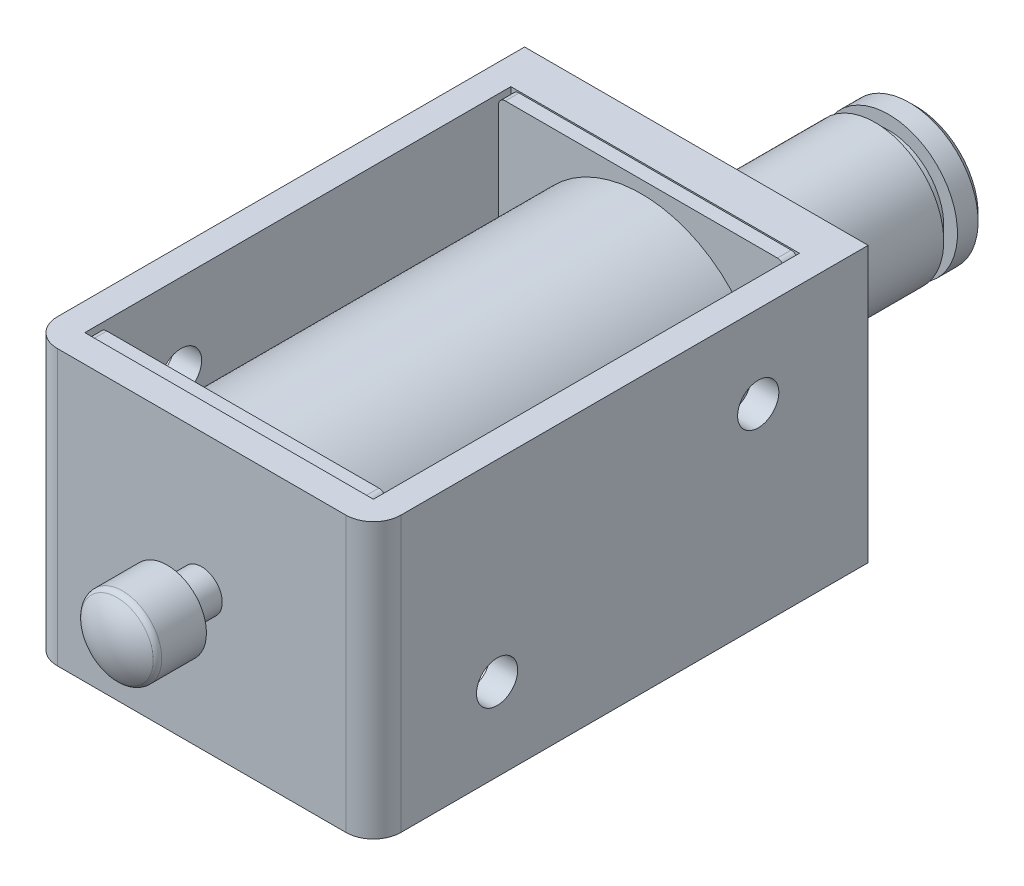
from build123d import *

# Parameters (mm, degrees)
SKETCH_1_W          = 21
SKETCH_1_H          = 31
EXTRUDE_1_DEPTH     = 20
CUT_EXTRUDE_5_REACH = 50.177
SKETCH_14_R         = 1.5
CUT_EXTRUDE_6_REACH = 50.177
SKETCH_15_R         = 1.5
EXTRUDE_2_DEPTH     = 1
EXTRUDE_START       = 1
EXTRUDE_3_DEPTH     = 1
SKETCH_4_R          = 1.5
CUT_EXTRUDE_1_DEPTH = 3
SKETCH_5_R          = 5
CUT_EXTRUDE_2_DEPTH = 4
SKETCH_6_W          = 9
SKETCH_6_H          = 29
EXTRUDE_START_2     = -8
SKETCH_7_R          = 1.5
EXTRUDE_4_DEPTH     = 8
EXTRUDE_START_3     = 20
SKETCH_8_R          = 5
EXTRUDE_5_DEPTH     = 20
SKETCH_10_R         = 1.75
CUT_EXTRUDE_4_DEPTH = 20
SKETCH_9_R          = 5
SKETCH_9_R_2        = 4
CUT_EXTRUDE_3_DEPTH = 1
SKETCH_11_R         = 2.85
EXTRUDE_6_DEPTH     = 3.5
FILLET_1_R          = 0.5
CHAMFER_1_SIZE      = 0.5


with BuildPart() as part:
    # ｽｹｯﾁ1 → ﾎﾞｽ - 押し出し1 (new body)
    with BuildSketch(Plane(origin=(0, 0, 0), x_dir=(1, 0, 0), z_dir=(0, 1, 0))):
        with BuildLine():
            Line((2, 0), (23, 0))
            ThreePointArc((23, 0), (24.414213562, 0.585786438), (25, 2))
            Line((25, 2), (25, 36))
            Line((25, 36), (0, 36))
            Line((0, 36), (0, 2))
            ThreePointArc((0, 2), (0.585786438, 0.585786438), (2, 0))
        make_face()
        with Locations((12.5, 17.5)):
            Rectangle(SKETCH_1_W, SKETCH_1_H, mode=Mode.SUBTRACT)
    extrude(amount=EXTRUDE_1_DEPTH)

    # ｽｹｯﾁ14 → ｶｯﾄ - 押し出し5 (cut, up to next)
    with BuildSketch(Plane(origin=(25, 0, 0), x_dir=(0, 0, -1), z_dir=(1, 0, 0)), mode=Mode.PRIVATE) as cut_extrude_5_sk1:
        with Locations((9, 6)):
            Circle(SKETCH_14_R)
    cut_extrude_5_tool1 = extrude(cut_extrude_5_sk1.sketch, amount=-CUT_EXTRUDE_5_REACH, mode=Mode.PRIVATE) & part.part
    # ｽｹｯﾁ14 → ｶｯﾄ - 押し出し5 (cut, up to next)
    with BuildSketch(Plane(origin=(25, 0, 0), x_dir=(0, 0, -1), z_dir=(1, 0, 0)), mode=Mode.PRIVATE) as cut_extrude_5_sk2:
        with Locations((28, 14)):
            Circle(SKETCH_14_R)
    cut_extrude_5_tool2 = extrude(cut_extrude_5_sk2.sketch, amount=-CUT_EXTRUDE_5_REACH, mode=Mode.PRIVATE) & part.part
    add(cut_extrude_5_tool1.solids().sort_by_distance((25, 6, -9))[0], mode=Mode.SUBTRACT)
    add(cut_extrude_5_tool2.solids().sort_by_distance((25, 14, -28))[0], mode=Mode.SUBTRACT)

    # ｽｹｯﾁ15 → ｶｯﾄ - 押し出し6 (cut, up to next)
    with BuildSketch(Plane.ZY, mode=Mode.PRIVATE) as cut_extrude_6_sk1:
        with Locations((-28, 6)):
            Circle(SKETCH_15_R)
    cut_extrude_6_tool1 = extrude(cut_extrude_6_sk1.sketch, amount=-CUT_EXTRUDE_6_REACH, mode=Mode.PRIVATE) & part.part
    # ｽｹｯﾁ15 → ｶｯﾄ - 押し出し6 (cut, up to next)
    with BuildSketch(Plane.ZY, mode=Mode.PRIVATE) as cut_extrude_6_sk2:
        with Locations((-9, 14)):
            Circle(SKETCH_15_R)
    cut_extrude_6_tool2 = extrude(cut_extrude_6_sk2.sketch, amount=-CUT_EXTRUDE_6_REACH, mode=Mode.PRIVATE) & part.part
    add(cut_extrude_6_tool1.solids().sort_by_distance((0, 6, -28))[0], mode=Mode.SUBTRACT)
    add(cut_extrude_6_tool2.solids().sort_by_distance((0, 14, -9))[0], mode=Mode.SUBTRACT)

    # ｽｹｯﾁ2 → ﾎﾞｽ - 押し出し2 (add)
    with BuildSketch(Plane(origin=(0, 0, -2), x_dir=(-1, 0, 0), z_dir=(0, 0, -1))):
        with BuildLine():
            Line((-22.4, 0.1), (-2.6, 0.1))
            ThreePointArc((-2.6, 0.1), (-2.246446609, 0.246446609), (-2.1, 0.6))
            Line((-2.1, 0.6), (-2.1, 19.4))
            ThreePointArc((-2.1, 19.4), (-2.246446609, 19.753553391), (-2.6, 19.9))
            Line((-2.6, 19.9), (-22.4, 19.9))
            ThreePointArc((-22.4, 19.9), (-22.753553391, 19.753553391), (-22.9, 19.4))
            Line((-22.9, 19.4), (-22.9, 0.6))
            ThreePointArc((-22.9, 0.6), (-22.753553391, 0.246446609), (-22.4, 0.1))
        make_face()
    extrude(amount=EXTRUDE_2_DEPTH)

    # ｽｹｯﾁ3 → ﾎﾞｽ - 押し出し3 (add)
    with BuildSketch(Plane.XY.offset(-33).offset(EXTRUDE_START)):
        with BuildLine():
            Line((2.6, 0.1), (22.4, 0.1))
            ThreePointArc((22.4, 0.1), (22.753553391, 0.246446609), (22.9, 0.6))
            Line((22.9, 0.6), (22.9, 19.4))
            ThreePointArc((22.9, 19.4), (22.753553391, 19.753553391), (22.4, 19.9))
            Line((22.4, 19.9), (2.6, 19.9))
            ThreePointArc((2.6, 19.9), (2.246446609, 19.753553391), (2.1, 19.4))
            Line((2.1, 19.4), (2.1, 0.6))
            ThreePointArc((2.1, 0.6), (2.246446609, 0.246446609), (2.6, 0.1))
        make_face()
    extrude(amount=-EXTRUDE_3_DEPTH)

    # ｽｹｯﾁ4 → ｶｯﾄ - 押し出し1 (cut)
    with BuildSketch(Plane.XY):
        with Locations((12.5, 10)):
            Circle(SKETCH_4_R)
    extrude(amount=-CUT_EXTRUDE_1_DEPTH, mode=Mode.SUBTRACT)

    # ｽｹｯﾁ5 → ｶｯﾄ - 押し出し2 (cut)
    with BuildSketch(Plane(origin=(0, 0, -36), x_dir=(-1, 0, 0), z_dir=(0, 0, -1))):
        with Locations((-12.5, 10)):
            Circle(SKETCH_5_R)
    extrude(amount=-CUT_EXTRUDE_2_DEPTH, mode=Mode.SUBTRACT)

    # ｽｹｯﾁ6 → 回転1 (revolve)
    with BuildSketch(Plane(origin=(0, 10, 0), x_dir=(1, 0, 0), z_dir=(0, 1, 0))):
        with Locations((8, 17.5)):
            Rectangle(SKETCH_6_W, SKETCH_6_H)
    revolve(axis=Axis((12.5, 10, -32), (0, 0, 1)))

    # ｽｹｯﾁ7 → ﾎﾞｽ - 押し出し4 (add)
    with BuildSketch(Plane(origin=(0, 0, -3), x_dir=(-1, 0, 0), z_dir=(0, 0, -1)).offset(EXTRUDE_START_2)):
        with Locations((-12.5, 10)):
            Circle(SKETCH_7_R)
    extrude(amount=EXTRUDE_4_DEPTH)

    # ｽｹｯﾁ8 → ﾎﾞｽ - 押し出し5 (add)
    with BuildSketch(Plane(origin=(0, 0, -32), x_dir=(-1, 0, 0), z_dir=(0, 0, -1)).offset(EXTRUDE_START_3)):
        with Locations((-12.5, 10)):
            Circle(SKETCH_8_R)
    extrude(amount=-EXTRUDE_5_DEPTH)

    # ｽｹｯﾁ10 → ｶｯﾄ - 押し出し4 (cut)
    with BuildSketch(Plane(origin=(0, 0, -52), x_dir=(-1, 0, 0), z_dir=(0, 0, -1))):
        with Locations((-12.5, 10)):
            Circle(SKETCH_10_R)
    extrude(amount=-CUT_EXTRUDE_4_DEPTH, mode=Mode.SUBTRACT)

    # ｽｹｯﾁ9 → ｶｯﾄ - 押し出し3 (cut)
    with BuildSketch(Plane(origin=(0, 0, -50), x_dir=(-1, 0, 0), z_dir=(0, 0, -1))):
        with Locations((-12.5, 10)):
            Circle(SKETCH_9_R)
        with Locations((-12.5, 10)):
            Circle(SKETCH_9_R_2, mode=Mode.SUBTRACT)
    extrude(amount=-CUT_EXTRUDE_3_DEPTH, mode=Mode.SUBTRACT)

    # ｽｹｯﾁ11 → ﾎﾞｽ - 押し出し6 (add)
    with BuildSketch(Plane.XY.offset(6)):
        with Locations((12.5, 10)):
            Circle(SKETCH_11_R)
    extrude(amount=-EXTRUDE_6_DEPTH)

    # ｽｹｯﾁ12 → 回転2 (revolve)
    with BuildSketch(Plane.ZY.offset(-12.5), mode=Mode.PRIVATE) as revolve_2_sk:
        with BuildLine():
            Line((6, 10), (7, 10))
            ThreePointArc((7, 10), (6.742745419, 11.510173831), (6, 12.85))
            Line((6, 12.85), (6, 10))
        make_face()
    revolve(revolve_2_sk.sketch.rotate(Axis((12.5, 10, 6), (0, 0, 1)), 270), axis=Axis((12.5, 10, 6), (0, 0, 1)))

    # ﾌｨﾚｯﾄ1
    fillet_1_edges = [part.edges().sort_by_distance(p)[0] for p in [
        (9.65, 10, 6),
    ]]
    fillet(fillet_1_edges, radius=FILLET_1_R)

    # 面取り1
    chamfer_1_edges = [part.edges().sort_by_distance(p)[0] for p in [
        (17.5, 10, -52),
    ]]
    chamfer(chamfer_1_edges, length=CHAMFER_1_SIZE)


solid = part.part
